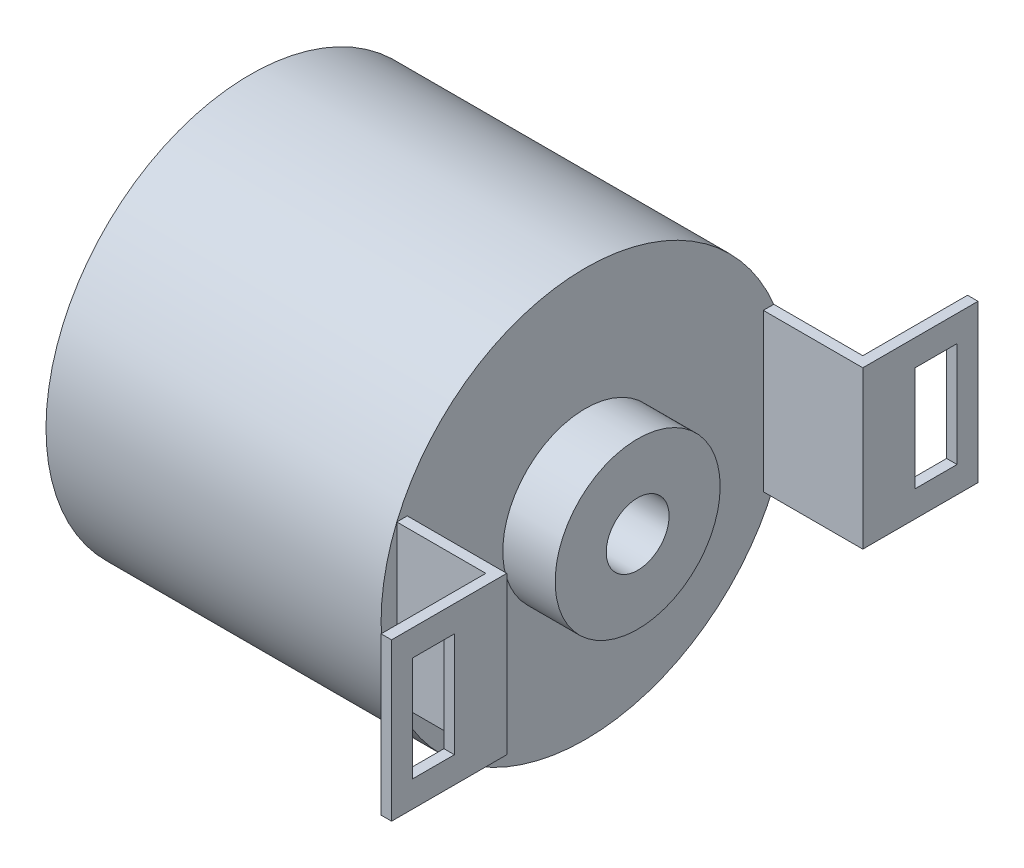
from build123d import *

# Parameters (mm, degrees)
SKETCH_1_R          = 19.5
EXTRUDE_1_DEPTH     = 32
SKETCH_2_R          = 7.88
EXTRUDE_2_DEPTH     = 5
CUT_EXTRUDE_1_REACH = 48.147
SKETCH_3_R          = 3
SKETCH_4_W          = 1
SKETCH_4_H          = 15
EXTRUDE_3_DEPTH     = 9.5
SKETCH_6_W          = 1
SKETCH_6_H          = 15
EXTRUDE_4_DEPTH     = 10
SKETCH_7_W          = 4
SKETCH_7_H          = 10
CUT_EXTRUDE_2_DEPTH = 10


with BuildPart() as part:
    # 草图1 → 凸台-拉伸1 (new body)
    with BuildSketch(Plane(origin=(0, 0, 0), x_dir=(0, 0, -1), z_dir=(1, 0, 0))):
        Circle(SKETCH_1_R)
    extrude(amount=EXTRUDE_1_DEPTH)

    # 草图2 → 凸台-拉伸2 (add)
    with BuildSketch(Plane(origin=(32, 0, 0), x_dir=(0, 0, -1), z_dir=(1, 0, 0))):
        Circle(SKETCH_2_R)
    extrude(amount=EXTRUDE_2_DEPTH)

    # 草图3 → 切除-拉伸1 (cut, up to next)
    with BuildSketch(Plane(origin=(37, 0, 0), x_dir=(0, 0, -1), z_dir=(1, 0, 0)), mode=Mode.PRIVATE) as cut_extrude_1_sk1:
        Circle(SKETCH_3_R)
    cut_extrude_1_tool1 = extrude(cut_extrude_1_sk1.sketch, amount=-CUT_EXTRUDE_1_REACH, mode=Mode.PRIVATE) & part.part
    add(cut_extrude_1_tool1.solids().sort_by_distance((37, 0, 0))[0], mode=Mode.SUBTRACT)

    # 草图4 → 凸台-拉伸3 (add)
    with BuildSketch(Plane(origin=(32, 0, 0), x_dir=(0, 0, -1), z_dir=(1, 0, 0))):
        with Locations((17.5, 0)):
            Rectangle(SKETCH_4_W, SKETCH_4_H)
    extrude_3 = extrude(amount=EXTRUDE_3_DEPTH)

    # 草图6 → 凸台-拉伸4 (add)
    with BuildSketch(Plane(origin=(0, 0, -18), x_dir=(-1, 0, 0), z_dir=(0, 0, -1))):
        with Locations((-41, 0)):
            Rectangle(SKETCH_6_W, SKETCH_6_H)
    extrude_4 = extrude(amount=EXTRUDE_4_DEPTH)

    # 草图7 → 切除-拉伸2 (cut)
    with BuildSketch(Plane(origin=(41.5, 0, 0), x_dir=(0, 0, -1), z_dir=(1, 0, 0))):
        with Locations((24, 0)):
            Rectangle(SKETCH_7_W, SKETCH_7_H)
    cut_extrude_2 = extrude(amount=-CUT_EXTRUDE_2_DEPTH, mode=Mode.SUBTRACT)

    # 镜向1: 凸台-拉伸3, 凸台-拉伸4, 切除-拉伸2 across plane
    add(extrude_3.mirror(Plane.XY))
    add(extrude_4.mirror(Plane.XY))
    add(cut_extrude_2.mirror(Plane.XY), mode=Mode.SUBTRACT)


solid = part.part
